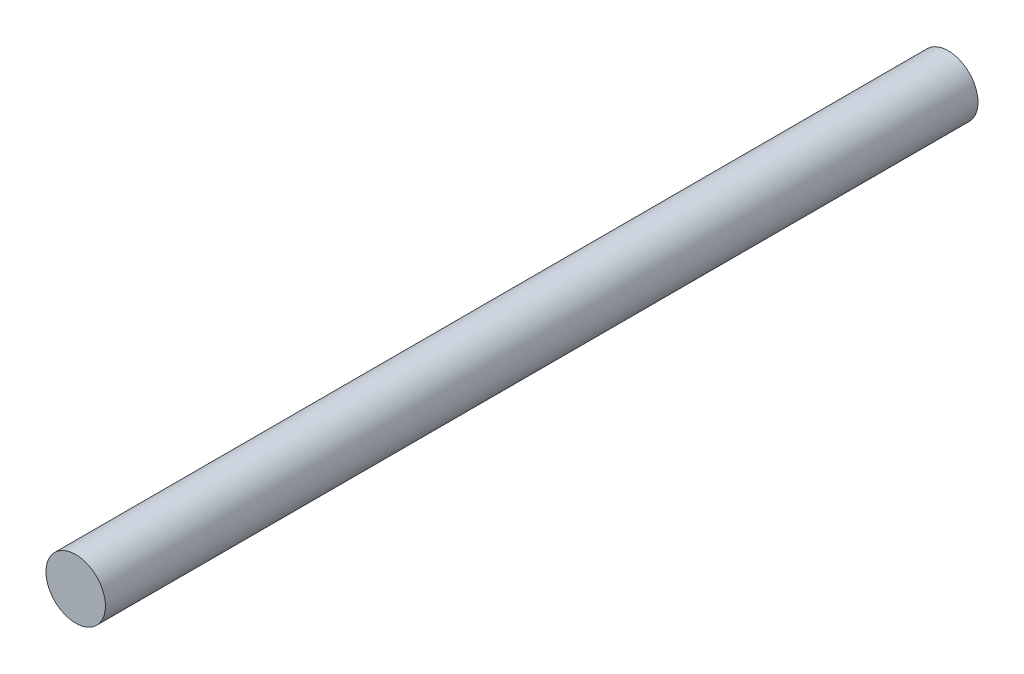
from build123d import *

# Parameters (mm, degrees)
SKETCH1_R           = 4.7625
BOSS_EXTRUDE1_DEPTH = 139.7


with BuildPart() as part:
    # Sketch1 → Boss-Extrude1 (new body)
    with BuildSketch(Plane.XY):
        Circle(SKETCH1_R)
    extrude(amount=BOSS_EXTRUDE1_DEPTH)


solid = part.part
